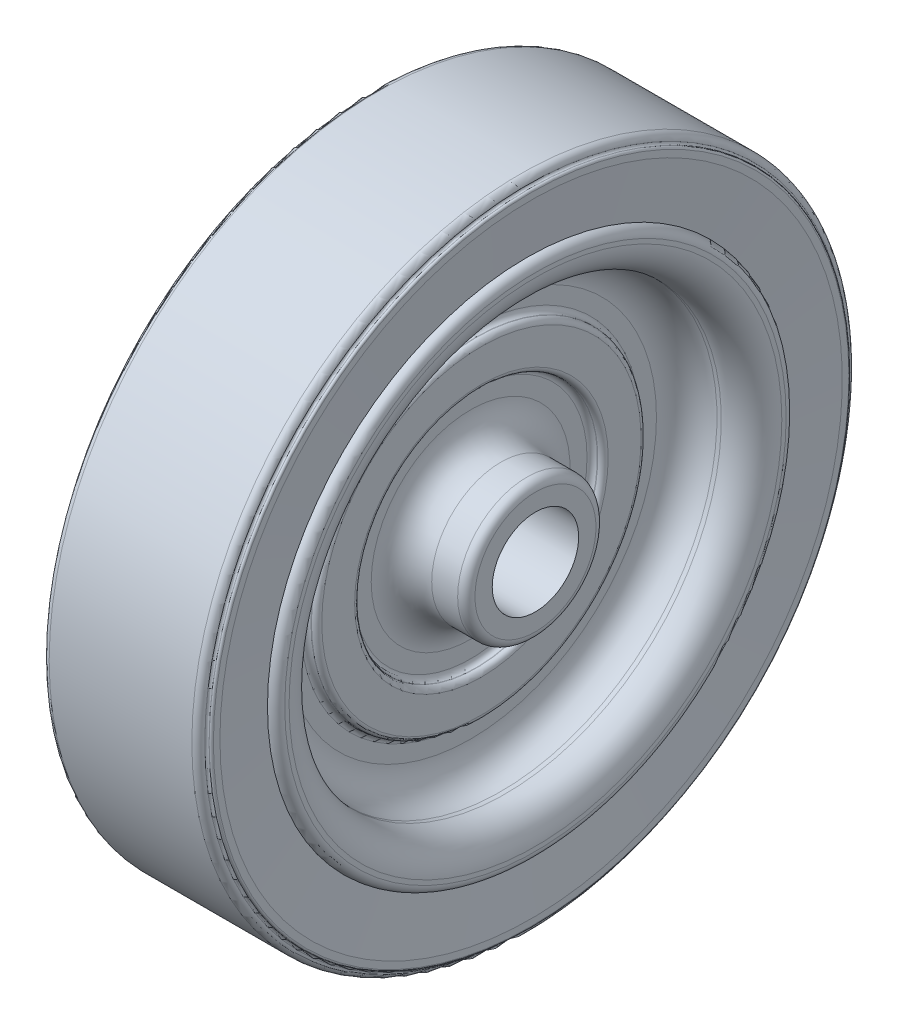
from build123d import *


with BuildPart() as part:
    # Sketch1 → Revolve1 (revolve)
    with BuildSketch(Plane.XY, mode=Mode.PRIVATE) as revolve1_sk:
        with BuildLine():
            Line((4.992760816, 38.135922425), (5.092760816, 38.135922425))
            ThreePointArc((5.092760816, 38.135922425), (5.941288954, 37.784450563), (6.292760816, 36.935922425))
            Line((6.292760816, 36.935922425), (6.292760816, 29.335922425))
            ThreePointArc((6.292760816, 29.335922425), (5.941288954, 28.487394288), (5.092760816, 28.135922425))
            Line((5.092760816, 28.135922425), (4.992760816, 28.135922425))
            ThreePointArc((4.992760816, 28.135922425), (4.144232679, 27.784450563), (3.792760816, 26.935922425))
            Line((3.792760816, 26.935922425), (3.792760816, 23))
            ThreePointArc((3.792760816, 23), (5.843013348, 18.050252532), (10.792760816, 16))
            Line((10.792760816, 16), (16.792760816, 16))
            ThreePointArc((16.792760816, 16), (18.206974379, 15.414213562), (18.792760816, 14))
            Line((18.792760816, 14), (18.792760816, 10))
            Line((18.792760816, 10), (-21.207239184, 10))
            Line((-21.207239184, 10), (-21.207239184, 14))
            ThreePointArc((-21.207239184, 14), (-20.621452746, 15.414213562), (-19.207239184, 16))
            Line((-19.207239184, 16), (-13.207239184, 16))
            ThreePointArc((-13.207239184, 16), (-8.257491716, 18.050252532), (-6.207239184, 23))
            Line((-6.207239184, 23), (-6.207239184, 26.935922425))
            ThreePointArc((-6.207239184, 26.935922425), (-6.558711046, 27.784450563), (-7.407239184, 28.135922425))
            Line((-7.407239184, 28.135922425), (-7.507239184, 28.135922425))
            ThreePointArc((-7.507239184, 28.135922425), (-8.355767321, 28.487394288), (-8.707239184, 29.335922425))
            Line((-8.707239184, 29.335922425), (-8.707239184, 36.935922425))
            ThreePointArc((-8.707239184, 36.935922425), (-8.355767321, 37.784450563), (-7.507239184, 38.135922425))
            Line((-7.507239184, 38.135922425), (-7.407239184, 38.135922425))
            ThreePointArc((-7.407239184, 38.135922425), (-6.558711046, 38.487394288), (-6.207239184, 39.335922425))
            Line((-6.207239184, 39.335922425), (-6.207239184, 43))
            ThreePointArc((-6.207239184, 43), (-8.257491716, 47.949747468), (-13.207239184, 50))
            Line((-13.207239184, 50), (-14.207239184, 50))
            ThreePointArc((-14.207239184, 50), (-19.156986652, 52.050252532), (-21.207239184, 57))
            Line((-21.207239184, 57), (-21.207239184, 58))
            ThreePointArc((-21.207239184, 58), (-20.621452746, 59.414213562), (-19.207239184, 60))
            Line((-19.207239184, 60), (16.792760816, 60))
            ThreePointArc((16.792760816, 60), (18.206974379, 59.414213562), (18.792760816, 58))
            Line((18.792760816, 58), (18.792760816, 57))
            ThreePointArc((18.792760816, 57), (16.742508284, 52.050252532), (11.792760816, 50))
            Line((11.792760816, 50), (10.792760816, 50))
            ThreePointArc((10.792760816, 50), (5.843013348, 47.949747468), (3.792760816, 43))
            Line((3.792760816, 43), (3.792760816, 39.335922425))
            ThreePointArc((3.792760816, 39.335922425), (4.144232679, 38.487394288), (4.992760816, 38.135922425))
        make_face()
    revolve(revolve1_sk.sketch.rotate(Axis((-29.507272567, 0, 0), (1, 0, 0)), 90), axis=Axis((-29.507272567, 0, 0), (1, 0, 0)))

    # Sketch2 → Revolve2 (revolve)
    with BuildSketch(Plane.XY, mode=Mode.PRIVATE) as revolve2_sk:
        with BuildLine():
            Line((-20.207239184, 72), (-19.207239184, 60))
            Line((-19.207239184, 60), (16.792760816, 60))
            Line((16.792760816, 60), (17.792760816, 72))
            Line((17.792760816, 72), (17.792760816, 73.51))
            ThreePointArc((17.792760816, 73.51), (17.649243139, 73.856482323), (17.302760816, 74))
            Line((17.302760816, 74), (17.282760816, 74))
            ThreePointArc((17.282760816, 74), (16.936278493, 74.143517677), (16.792760816, 74.49))
            Line((16.792760816, 74.49), (16.792760816, 74.5))
            ThreePointArc((16.792760816, 74.5), (16.353420988, 75.560660172), (15.292760816, 76))
            Line((15.292760816, 76), (-17.707239184, 76))
            ThreePointArc((-17.707239184, 76), (-18.767899356, 75.560660172), (-19.207239184, 74.5))
            Line((-19.207239184, 74.5), (-19.207239184, 74.488690702))
            ThreePointArc((-19.207239184, 74.488690702), (-19.350373376, 74.143134193), (-19.695929886, 74))
            Line((-19.695929886, 74), (-19.718548482, 74))
            ThreePointArc((-19.718548482, 74), (-20.064104991, 73.856865807), (-20.207239184, 73.511309298))
            Line((-20.207239184, 73.511309298), (-20.207239184, 72))
        make_face()
    revolve(revolve2_sk.sketch.rotate(Axis((-37.506128167, 0, 0), (1, 0, 0)), 90), axis=Axis((-37.506128167, 0, 0), (1, 0, 0)))


solid = part.part
